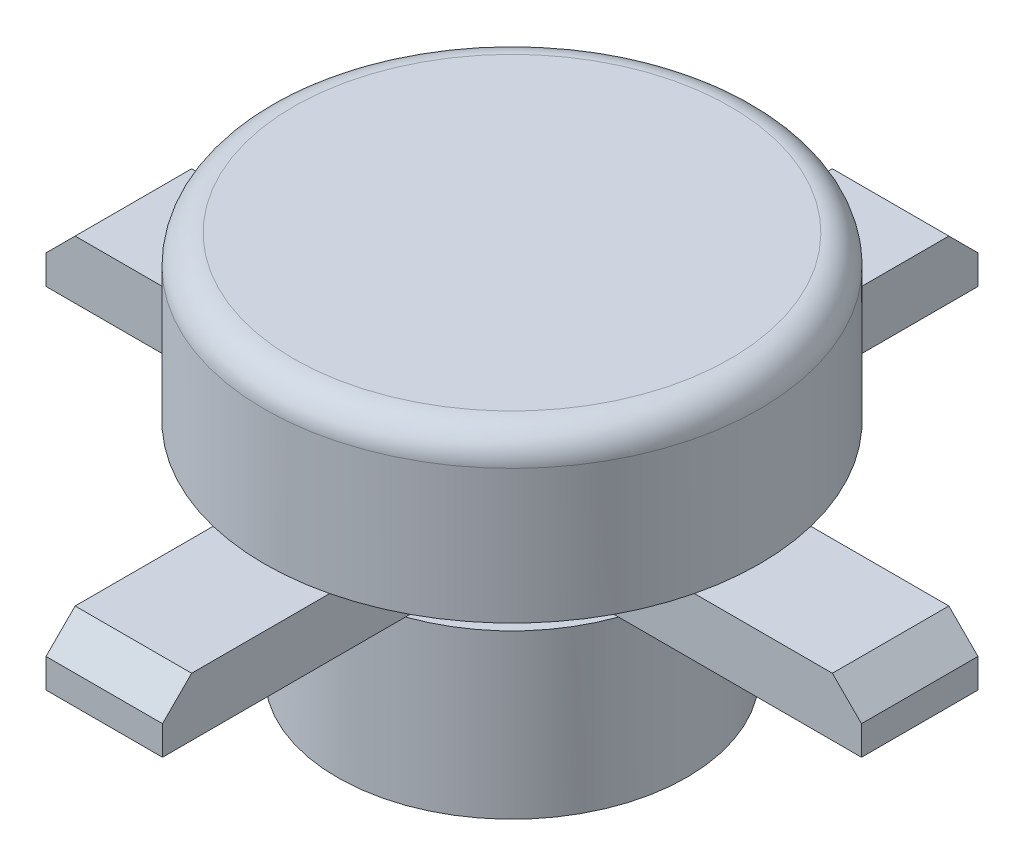
from build123d import *

# Parameters (mm, degrees)
SKETCH_1_R      = 4.25
EXTRUDE_1_DEPTH = 2.8
FILLET_1_R      = 0.5
SKETCH_2_W      = 14
SKETCH_2_H      = 2
EXTRUDE_2_DEPTH = 1
SKETCH_3_W      = 2
SKETCH_3_H      = 14
EXTRUDE_3_DEPTH = 1
CHAMFER_1_SIZE  = 0.5
CHAMFER_2_SIZE  = 0.5
CHAMFER_3_SIZE  = 0.5
SKETCH_4_R      = 3
EXTRUDE_4_DEPTH = 2.8


with BuildPart() as part:
    # 草图1 → 凸台-拉伸1 (new body)
    with BuildSketch(Plane(origin=(0, 0, 0), x_dir=(1, 0, 0), z_dir=(0, 1, 0))):
        with Locations(Location((0, 0, 0), (0, 0, 270))):
            Circle(SKETCH_1_R)
    extrude(amount=EXTRUDE_1_DEPTH)

    # 圆角1
    fillet_1_edges = [part.edges().sort_by_distance(p)[0] for p in [
        (0, 2.8, -4.25),
    ]]
    fillet(fillet_1_edges, radius=FILLET_1_R)

    # 草图2 → 凸台-拉伸2 (add)
    with BuildSketch(Plane.XZ):
        Rectangle(SKETCH_2_W, SKETCH_2_H)
    extrude(amount=EXTRUDE_2_DEPTH)

    # 草图3 → 凸台-拉伸3 (add)
    with BuildSketch(Plane.XZ):
        Rectangle(SKETCH_3_W, SKETCH_3_H)
    extrude(amount=EXTRUDE_3_DEPTH)

    # 倒角1
    chamfer_1_edges = [part.edges().sort_by_distance(p)[0] for p in [
        (0, 0, 7),
    ]]
    chamfer(chamfer_1_edges, length=CHAMFER_1_SIZE)

    # 倒角2
    chamfer_2_edges = [part.edges().sort_by_distance(p)[0] for p in [
        (7, 0, 0),
    ]]
    chamfer(chamfer_2_edges, length=CHAMFER_2_SIZE)

    # 倒角3
    chamfer_3_edges = [part.edges().sort_by_distance(p)[0] for p in [
        (-7, 0, 0),
        (0, 0, -7),
    ]]
    chamfer(chamfer_3_edges, length=CHAMFER_3_SIZE)

    # 草图4 → 凸台-拉伸4 (add)
    with BuildSketch(Plane.XZ.offset(1)):
        with Locations(Location((0, 0, 0), (0, 0, 70.528779366))):
            Circle(SKETCH_4_R)
    extrude(amount=EXTRUDE_4_DEPTH)


solid = part.part
